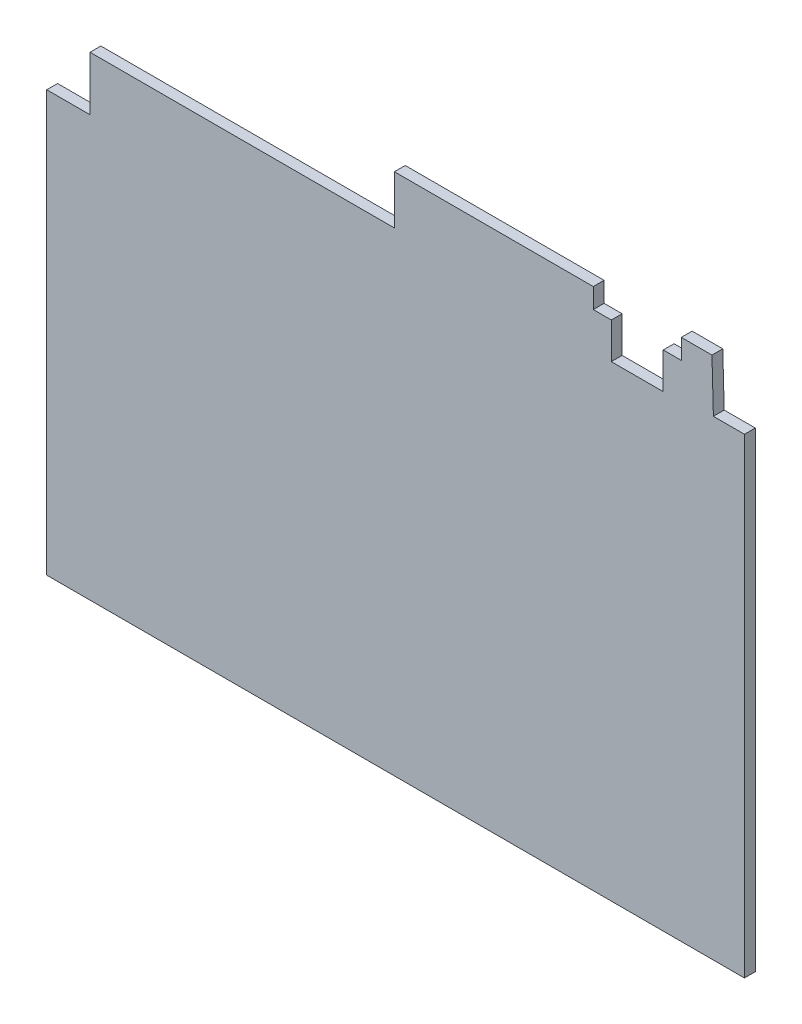
from build123d import *

# Parameters (mm, degrees)
BOSS_EXTRUDE1_DEPTH = 6
SKETCH2_W           = 30
SKETCH2_H           = 30
CUT_EXTRUDE1_DEPTH  = 10
SKETCH3_W           = 398.694966145
SKETCH3_H           = 1
CUT_EXTRUDE2_DEPTH  = 10
SKETCH4_W           = 6
SKETCH4_H           = 233
SKETCH4_H_2         = 258.947078575
CUT_EXTRUDE3_DEPTH  = 10
SKETCH5_W           = 23
SKETCH5_H           = 31.052921425
CUT_EXTRUDE4_DEPTH  = 10
SKETCH6_W           = 10
SKETCH6_H           = 20
BOSS_EXTRUDE2_DEPTH = 6
SKETCH7_W           = 17.21166374
SKETCH7_H           = 2.05
BOSS_EXTRUDE3_DEPTH = 6


with BuildPart() as part:
    # Sketch1 → Boss-Extrude1 (new body)
    with BuildSketch(Plane.XY):
        Polygon((28.571428571, 236.060202245), (28.571428571, 237.05184048), (5.415486436, 237.05184048), (4.571428571, 268.104761905), (-12.428571429, 268.104761905), (-12.428571429, 237.05184048), (-38.216595912, 237.05184048), (-38.216595912, 268.104761905), (-171.428571429, 268.104761905), (-171.428571429, 241.104761905), (-370.123537574, 241.104761905), (-370.123537574, -22.895238095), (28.571428571, -22.895238095), align=None)
    extrude(amount=BOSS_EXTRUDE1_DEPTH)

    # Sketch2 → Cut-Extrude1 (cut)
    with BuildSketch(Plane.XY.offset(6)):
        with Locations((-355.123537574, 226.104761905)):
            Rectangle(SKETCH2_W, SKETCH2_H)
    extrude(amount=-CUT_EXTRUDE1_DEPTH, mode=Mode.SUBTRACT)

    # Sketch3 → Cut-Extrude2 (cut)
    with BuildSketch(Plane.XY.offset(6)):
        with Locations((-170.776054501, -22.395238095)):
            Rectangle(SKETCH3_W, SKETCH3_H)
    extrude(amount=-CUT_EXTRUDE2_DEPTH, mode=Mode.SUBTRACT)

    # Sketch4 → Cut-Extrude3 (cut)
    with BuildSketch(Plane.XY.offset(6)):
        with Locations((-367.123537574, 94.604761905)):
            Rectangle(SKETCH4_W, SKETCH4_H)
        with Locations((25.571428571, 107.578301193)):
            Rectangle(SKETCH4_W, SKETCH4_H_2)
    extrude(amount=-CUT_EXTRUDE3_DEPTH, mode=Mode.SUBTRACT)

    # Sketch5 → Cut-Extrude4 (cut)
    with BuildSketch(Plane.XY.offset(6)):
        with Locations((-49.716595912, 252.578301193)):
            Rectangle(SKETCH5_W, SKETCH5_H)
    extrude(amount=-CUT_EXTRUDE4_DEPTH, mode=Mode.SUBTRACT)

    # Sketch6 → Boss-Extrude2 (add)
    with BuildSketch(Plane.XY.offset(6)):
        with Locations((-17.428571429, 247.05184048)):
            Rectangle(SKETCH6_W, SKETCH6_H)
        with Locations((-56.216595912, 247.05184048)):
            Rectangle(SKETCH6_W, SKETCH6_H)
    extrude(amount=-BOSS_EXTRUDE2_DEPTH)

    # Sketch7 → Boss-Extrude3 (add)
    with BuildSketch(Plane.XY.offset(6)):
        with Locations((13.965596701, 238.07684048)):
            Rectangle(SKETCH7_W, SKETCH7_H)
    extrude(amount=-BOSS_EXTRUDE3_DEPTH)


solid = part.part
